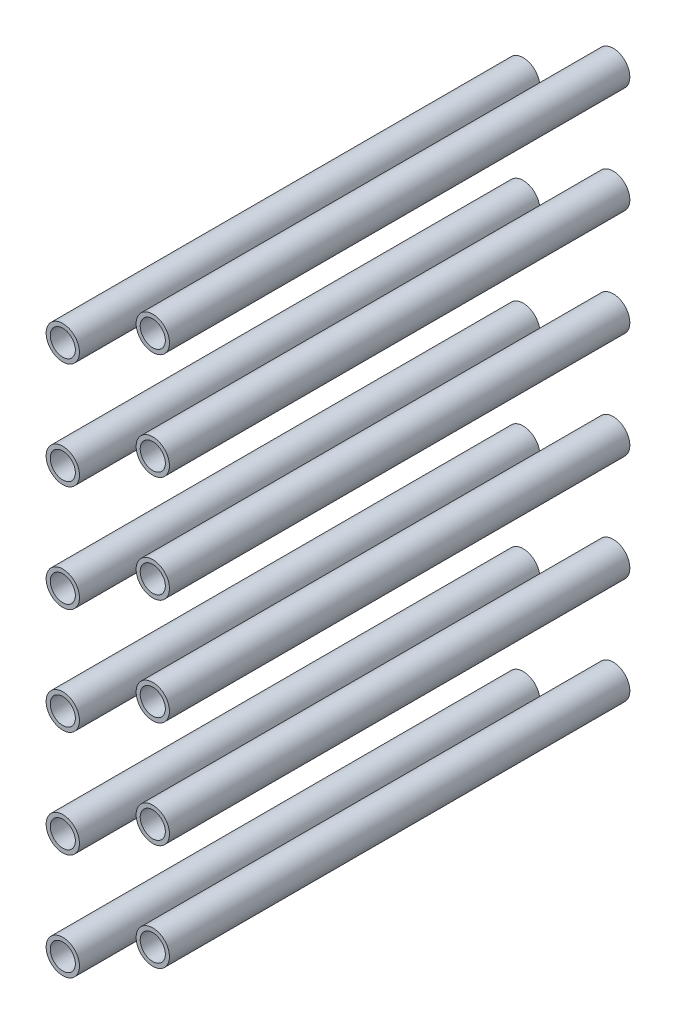
from build123d import *

# Parameters (mm, degrees)
ESBO_O1_R                   = 3.98
ESBO_O1_R_2                 = 3
RESSALTO_EXTRUS_O1_DEPTH    = 110
RESSALTO_EXTRUS_O1_2_DEPTH  = 110
RESSALTO_EXTRUS_O1_3_DEPTH  = 110
RESSALTO_EXTRUS_O1_4_DEPTH  = 110
RESSALTO_EXTRUS_O1_5_DEPTH  = 110
RESSALTO_EXTRUS_O1_6_DEPTH  = 110
RESSALTO_EXTRUS_O1_7_DEPTH  = 110
RESSALTO_EXTRUS_O1_8_DEPTH  = 110
RESSALTO_EXTRUS_O1_9_DEPTH  = 110
RESSALTO_EXTRUS_O1_10_DEPTH = 110
RESSALTO_EXTRUS_O1_11_DEPTH = 110
RESSALTO_EXTRUS_O1_12_DEPTH = 110


with BuildPart() as part:
    # Esboço1 → Ressalto-extrusão1 (new body)
    with BuildSketch(Plane.XY):
        Circle(ESBO_O1_R)
        Circle(ESBO_O1_R_2, mode=Mode.SUBTRACT)
    extrude(amount=-RESSALTO_EXTRUS_O1_DEPTH)


with BuildPart() as body_2:
    # Esboço1 → Ressalto-extrus_o1 2 (new body)
    with BuildSketch(Plane.XY):
        with Locations((21.5, 12.7)):
            Circle(ESBO_O1_R)
        with Locations((21.5, 12.7)):
            Circle(ESBO_O1_R_2, mode=Mode.SUBTRACT)
    extrude(amount=-RESSALTO_EXTRUS_O1_2_DEPTH)


with BuildPart() as body_3:
    # Esboço1 → Ressalto-extrus_o1 3 (new body)
    with BuildSketch(Plane.XY):
        with Locations((0, 25.4)):
            Circle(ESBO_O1_R)
        with Locations((0, 25.4)):
            Circle(ESBO_O1_R_2, mode=Mode.SUBTRACT)
    extrude(amount=-RESSALTO_EXTRUS_O1_3_DEPTH)


with BuildPart() as body_4:
    # Esboço1 → Ressalto-extrus_o1 4 (new body)
    with BuildSketch(Plane.XY):
        with Locations((0, 50.8)):
            Circle(ESBO_O1_R)
        with Locations((0, 50.8)):
            Circle(ESBO_O1_R_2, mode=Mode.SUBTRACT)
    extrude(amount=-RESSALTO_EXTRUS_O1_4_DEPTH)


with BuildPart() as body_5:
    # Esboço1 → Ressalto-extrus_o1 5 (new body)
    with BuildSketch(Plane.XY):
        with Locations((0, 76.2)):
            Circle(ESBO_O1_R)
        with Locations((0, 76.2)):
            Circle(ESBO_O1_R_2, mode=Mode.SUBTRACT)
    extrude(amount=-RESSALTO_EXTRUS_O1_5_DEPTH)


with BuildPart() as body_6:
    # Esboço1 → Ressalto-extrus_o1 6 (new body)
    with BuildSketch(Plane.XY):
        with Locations((0, 101.6)):
            Circle(ESBO_O1_R)
        with Locations((0, 101.6)):
            Circle(ESBO_O1_R_2, mode=Mode.SUBTRACT)
    extrude(amount=-RESSALTO_EXTRUS_O1_6_DEPTH)


with BuildPart() as body_7:
    # Esboço1 → Ressalto-extrus_o1 7 (new body)
    with BuildSketch(Plane.XY):
        with Locations((0, 127)):
            Circle(ESBO_O1_R)
        with Locations((0, 127)):
            Circle(ESBO_O1_R_2, mode=Mode.SUBTRACT)
    extrude(amount=-RESSALTO_EXTRUS_O1_7_DEPTH)


with BuildPart() as body_8:
    # Esboço1 → Ressalto-extrus_o1 8 (new body)
    with BuildSketch(Plane.XY):
        with Locations((21.5, 38.1)):
            Circle(ESBO_O1_R)
        with Locations((21.5, 38.1)):
            Circle(ESBO_O1_R_2, mode=Mode.SUBTRACT)
    extrude(amount=-RESSALTO_EXTRUS_O1_8_DEPTH)


with BuildPart() as body_9:
    # Esboço1 → Ressalto-extrus_o1 9 (new body)
    with BuildSketch(Plane.XY):
        with Locations((21.5, 63.5)):
            Circle(ESBO_O1_R)
        with Locations((21.5, 63.5)):
            Circle(ESBO_O1_R_2, mode=Mode.SUBTRACT)
    extrude(amount=-RESSALTO_EXTRUS_O1_9_DEPTH)


with BuildPart() as body_10:
    # Esboço1 → Ressalto-extrus_o1 10 (new body)
    with BuildSketch(Plane.XY):
        with Locations((21.5, 88.9)):
            Circle(ESBO_O1_R)
        with Locations((21.5, 88.9)):
            Circle(ESBO_O1_R_2, mode=Mode.SUBTRACT)
    extrude(amount=-RESSALTO_EXTRUS_O1_10_DEPTH)


with BuildPart() as body_11:
    # Esboço1 → Ressalto-extrus_o1 11 (new body)
    with BuildSketch(Plane.XY):
        with Locations((21.5, 114.3)):
            Circle(ESBO_O1_R)
        with Locations((21.5, 114.3)):
            Circle(ESBO_O1_R_2, mode=Mode.SUBTRACT)
    extrude(amount=-RESSALTO_EXTRUS_O1_11_DEPTH)


with BuildPart() as body_12:
    # Esboço1 → Ressalto-extrus_o1 12 (new body)
    with BuildSketch(Plane.XY):
        with Locations((21.5, 139.7)):
            Circle(ESBO_O1_R)
        with Locations((21.5, 139.7)):
            Circle(ESBO_O1_R_2, mode=Mode.SUBTRACT)
    extrude(amount=-RESSALTO_EXTRUS_O1_12_DEPTH)


solid = Compound([part.part, body_2.part, body_3.part, body_4.part, body_5.part, body_6.part, body_7.part, body_8.part, body_9.part, body_10.part, body_11.part, body_12.part])
